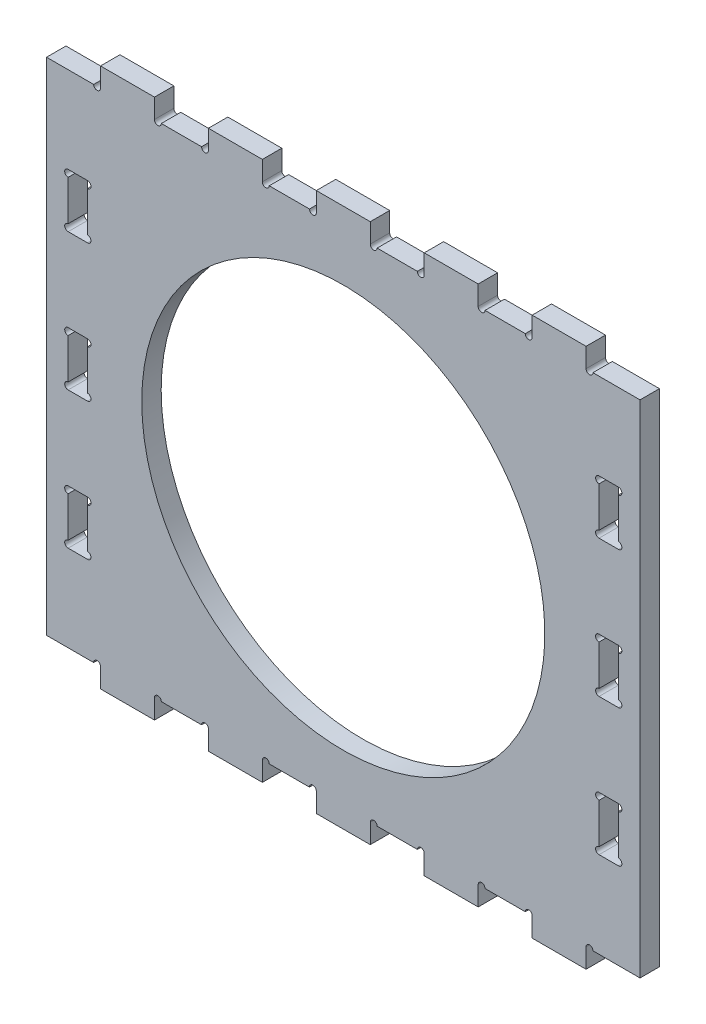
from build123d import *

# Parameters (mm, degrees)
ESTRUSIONE_ESTRUSIONE1_DEPTH = 18
TAGLIO_ESTRUSIONE1_DEPTH     = 47
TAGLIO_ESTRUSIONE2_DEPTH     = 32
TAGLIO_ESTRUSIONE3_DEPTH     = 50
TAGLIO_ESTRUSIONE4_DEPTH     = 44
TAGLIO_ESTRUSIONE5_DEPTH     = 38
TAGLIO_ESTRUSIONE6_DEPTH     = 44
MODEL_11_R                   = 186.766541562
TAGLIO_ESTRUSIONE7_DEPTH     = 91


with BuildPart() as part:
    # Model → Estrusione-Estrusione1 (new body)
    with BuildSketch(Plane.XY):
        with BuildLine():
            Line((-275, -232), (-275, 232))
            Line((-275, 232), (-231.35, 232))
            ThreePointArc((-231.35, 232), (-228.175, 228.825), (-225, 232))
            Line((-225, 232), (-225, 250))
            Line((-225, 250), (-175, 250))
            Line((-175, 250), (-175, 232))
            ThreePointArc((-175, 232), (-171.825, 228.825), (-168.65, 232))
            Line((-168.65, 232), (-131.35, 232))
            ThreePointArc((-131.35, 232), (-128.175, 228.825), (-125, 232))
            Line((-125, 232), (-125, 250))
            Line((-125, 250), (-75, 250))
            Line((-75, 250), (-75, 232))
            ThreePointArc((-75, 232), (-71.825, 228.825), (-68.65, 232))
            Line((-68.65, 232), (-31.35, 232))
            ThreePointArc((-31.35, 232), (-28.175, 228.825), (-25, 232))
            Line((-25, 232), (-25, 250))
            Line((-25, 250), (25, 250))
            Line((25, 250), (25, 232))
            ThreePointArc((25, 232), (28.175, 228.825), (31.35, 232))
            Line((31.35, 232), (68.65, 232))
            ThreePointArc((68.65, 232), (71.825, 228.825), (75, 232))
            Line((75, 232), (75, 250))
            Line((75, 250), (125, 250))
            Line((125, 250), (125, 232))
            ThreePointArc((125, 232), (128.175, 228.825), (131.35, 232))
            Line((131.35, 232), (168.65, 232))
            ThreePointArc((168.65, 232), (171.825, 228.825), (175, 232))
            Line((175, 232), (175, 250))
            Line((175, 250), (225, 250))
            Line((225, 250), (225, 232))
            ThreePointArc((225, 232), (228.175, 228.825), (231.35, 232))
            Line((231.35, 232), (275, 232))
            Line((275, 232), (275, -232))
            Line((275, -232), (231.35, -232))
            ThreePointArc((231.35, -232), (228.175, -228.825), (225, -232))
            Line((225, -232), (225, -250))
            Line((225, -250), (175, -250))
            Line((175, -250), (175, -232))
            ThreePointArc((175, -232), (171.825, -228.825), (168.65, -232))
            Line((168.65, -232), (131.35, -232))
            ThreePointArc((131.35, -232), (128.175, -228.825), (125, -232))
            Line((125, -232), (125, -250))
            Line((125, -250), (75, -250))
            Line((75, -250), (75, -232))
            ThreePointArc((75, -232), (71.825, -228.825), (68.65, -232))
            Line((68.65, -232), (31.35, -232))
            ThreePointArc((31.35, -232), (28.175, -228.825), (25, -232))
            Line((25, -232), (25, -250))
            Line((25, -250), (-25, -250))
            Line((-25, -250), (-25, -232))
            ThreePointArc((-25, -232), (-28.175, -228.825), (-31.35, -232))
            Line((-31.35, -232), (-68.65, -232))
            ThreePointArc((-68.65, -232), (-71.825, -228.825), (-75, -232))
            Line((-75, -232), (-75, -250))
            Line((-75, -250), (-125, -250))
            Line((-125, -250), (-125, -232))
            ThreePointArc((-125, -232), (-128.175, -228.825), (-131.35, -232))
            Line((-131.35, -232), (-168.65, -232))
            ThreePointArc((-168.65, -232), (-171.825, -228.825), (-175, -232))
            Line((-175, -232), (-175, -250))
            Line((-175, -250), (-225, -250))
            Line((-225, -250), (-225, -232))
            ThreePointArc((-225, -232), (-228.175, -228.825), (-231.35, -232))
            Line((-231.35, -232), (-275, -232))
        make_face()
    extrude(amount=ESTRUSIONE_ESTRUSIONE1_DEPTH)

    # Model<3> → Taglio-Estrusione1 (cut)
    with BuildSketch(Plane.XY):
        with BuildLine():
            Line((-255, 145.65), (-255, 108.35))
            ThreePointArc((-255, 108.35), (-258.175, 105.175), (-255, 102))
            Line((-255, 102), (-237, 102))
            ThreePointArc((-237, 102), (-233.825, 105.175), (-237, 108.35))
            Line((-237, 108.35), (-237, 145.65))
            ThreePointArc((-237, 145.65), (-233.825, 148.825), (-237, 152))
            Line((-237, 152), (-255, 152))
            ThreePointArc((-255, 152), (-258.175, 148.825), (-255, 145.65))
        make_face()
    extrude(amount=TAGLIO_ESTRUSIONE1_DEPTH, mode=Mode.SUBTRACT)

    # Model<4> → Taglio-Estrusione2 (cut)
    with BuildSketch(Plane.XY):
        with BuildLine():
            Line((-255, -18.65), (-255, 18.65))
            ThreePointArc((-255, 18.65), (-258.175, 21.825), (-255, 25))
            Line((-255, 25), (-237, 25))
            ThreePointArc((-237, 25), (-233.825, 21.825), (-237, 18.65))
            Line((-237, 18.65), (-237, -18.65))
            ThreePointArc((-237, -18.65), (-233.825, -21.825), (-237, -25))
            Line((-237, -25), (-255, -25))
            ThreePointArc((-255, -25), (-258.175, -21.825), (-255, -18.65))
        make_face()
    extrude(amount=TAGLIO_ESTRUSIONE2_DEPTH, mode=Mode.SUBTRACT)

    # Model<5> → Taglio-Estrusione3 (cut)
    with BuildSketch(Plane.XY):
        with BuildLine():
            Line((-255, -145.65), (-255, -108.35))
            ThreePointArc((-255, -108.35), (-258.175, -105.175), (-255, -102))
            Line((-255, -102), (-237, -102))
            ThreePointArc((-237, -102), (-233.825, -105.175), (-237, -108.35))
            Line((-237, -108.35), (-237, -145.65))
            ThreePointArc((-237, -145.65), (-233.825, -148.825), (-237, -152))
            Line((-237, -152), (-255, -152))
            ThreePointArc((-255, -152), (-258.175, -148.825), (-255, -145.65))
        make_face()
    extrude(amount=TAGLIO_ESTRUSIONE3_DEPTH, mode=Mode.SUBTRACT)

    # Model<6> → Taglio-Estrusione4 (cut)
    with BuildSketch(Plane.XY):
        with BuildLine():
            Line((237, 145.65), (237, 108.35))
            ThreePointArc((237, 108.35), (233.825, 105.175), (237, 102))
            Line((237, 102), (255, 102))
            ThreePointArc((255, 102), (258.175, 105.175), (255, 108.35))
            Line((255, 108.35), (255, 145.65))
            ThreePointArc((255, 145.65), (258.175, 148.825), (255, 152))
            Line((255, 152), (237, 152))
            ThreePointArc((237, 152), (233.825, 148.825), (237, 145.65))
        make_face()
    extrude(amount=TAGLIO_ESTRUSIONE4_DEPTH, mode=Mode.SUBTRACT)

    # Model<7> → Taglio-Estrusione5 (cut)
    with BuildSketch(Plane.XY):
        with BuildLine():
            Line((237, -18.65), (237, 18.65))
            ThreePointArc((237, 18.65), (233.825, 21.825), (237, 25))
            Line((237, 25), (255, 25))
            ThreePointArc((255, 25), (258.175, 21.825), (255, 18.65))
            Line((255, 18.65), (255, -18.65))
            ThreePointArc((255, -18.65), (258.175, -21.825), (255, -25))
            Line((255, -25), (237, -25))
            ThreePointArc((237, -25), (233.825, -21.825), (237, -18.65))
        make_face()
    extrude(amount=TAGLIO_ESTRUSIONE5_DEPTH, mode=Mode.SUBTRACT)

    # Model<10> → Taglio-Estrusione6 (cut)
    with BuildSketch(Plane.XY):
        with BuildLine():
            Line((237, -145.65), (237, -108.35))
            ThreePointArc((237, -108.35), (233.825, -105.175), (237, -102))
            Line((237, -102), (255, -102))
            ThreePointArc((255, -102), (258.175, -105.175), (255, -108.35))
            Line((255, -108.35), (255, -145.65))
            ThreePointArc((255, -145.65), (258.175, -148.825), (255, -152))
            Line((255, -152), (237, -152))
            ThreePointArc((237, -152), (233.825, -148.825), (237, -145.65))
        make_face()
    extrude(amount=TAGLIO_ESTRUSIONE6_DEPTH, mode=Mode.SUBTRACT)

    # Model<11> → Taglio-Estrusione7 (cut)
    with BuildSketch(Plane.XY):
        Circle(MODEL_11_R)
    extrude(amount=TAGLIO_ESTRUSIONE7_DEPTH, mode=Mode.SUBTRACT)


solid = part.part
